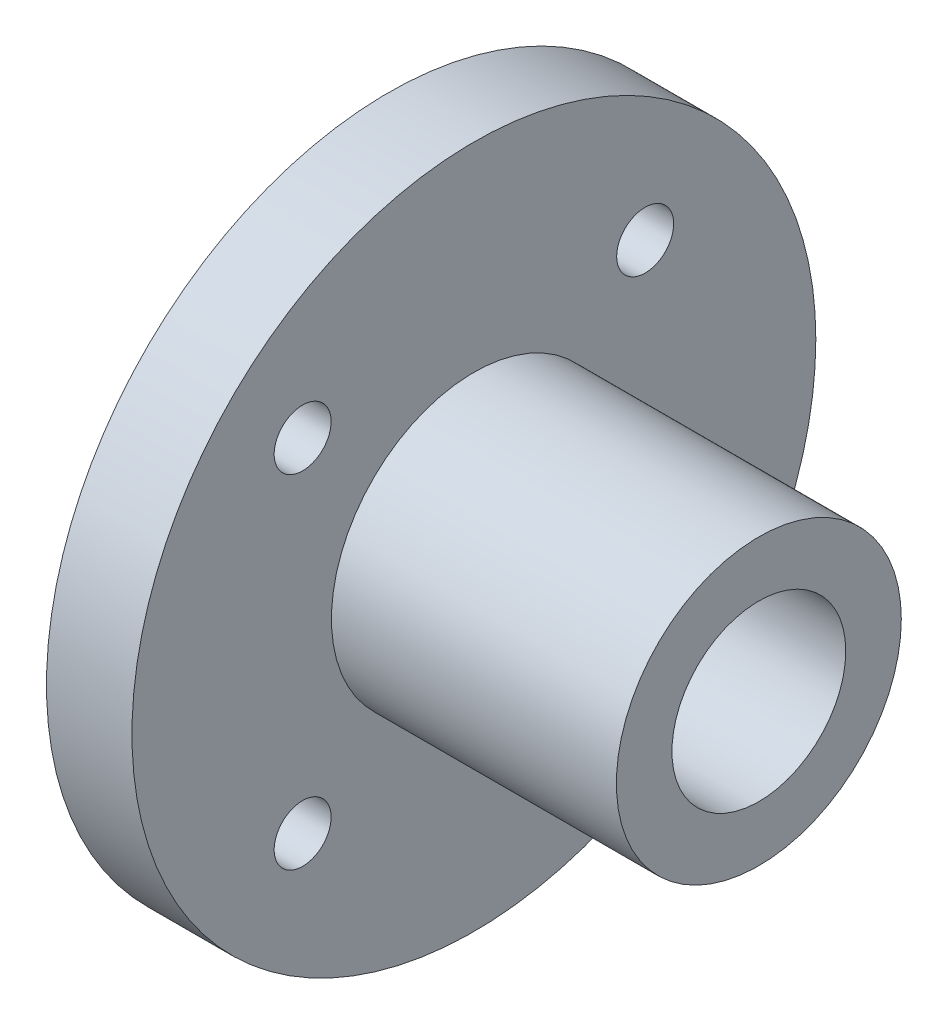
from build123d import *

# Parameters (mm, degrees)
SKETCH1_R           = 12
SKETCH1_R_2         = 3.05
BOSS_EXTRUDE1_DEPTH = 3
BOSS_EXTRUDE2_START = 10
SKETCH1_3_R         = 5
SKETCH1_3_R_2       = 3.05
BOSS_EXTRUDE2_DEPTH = 10
SKETCH2_R           = 1
CUT_EXTRUDE1_DEPTH  = 10


with BuildPart() as part:
    # Sketch1 → Boss-Extrude1 (new body)
    with BuildSketch(Plane(origin=(0, 0, 0), x_dir=(0, 0, -1), z_dir=(1, 0, 0))):
        Circle(SKETCH1_R)
        Circle(SKETCH1_R_2, mode=Mode.SUBTRACT)
    extrude(amount=-BOSS_EXTRUDE1_DEPTH)

    # Sketch1<3> → Boss-Extrude2 (add)
    with BuildSketch(Plane(origin=(0, 0, 0), x_dir=(0, 0, -1), z_dir=(1, 0, 0)).offset(BOSS_EXTRUDE2_START)):
        Circle(SKETCH1_3_R)
        Circle(SKETCH1_3_R_2, mode=Mode.SUBTRACT)
    extrude(amount=-BOSS_EXTRUDE2_DEPTH)

    # Sketch2 → Cut-Extrude1 (cut)
    with BuildSketch(Plane.ZY.offset(3)):
        with Locations((-6.01040764, 6.01040764)):
            Circle(SKETCH2_R)
        with Locations((-6.01040764, -6.01040764)):
            Circle(SKETCH2_R)
        with Locations((6.01040764, 6.01040764)):
            Circle(SKETCH2_R)
        with Locations((6.01040764, -6.01040764)):
            Circle(SKETCH2_R)
    extrude(amount=-CUT_EXTRUDE1_DEPTH, mode=Mode.SUBTRACT)


solid = part.part
